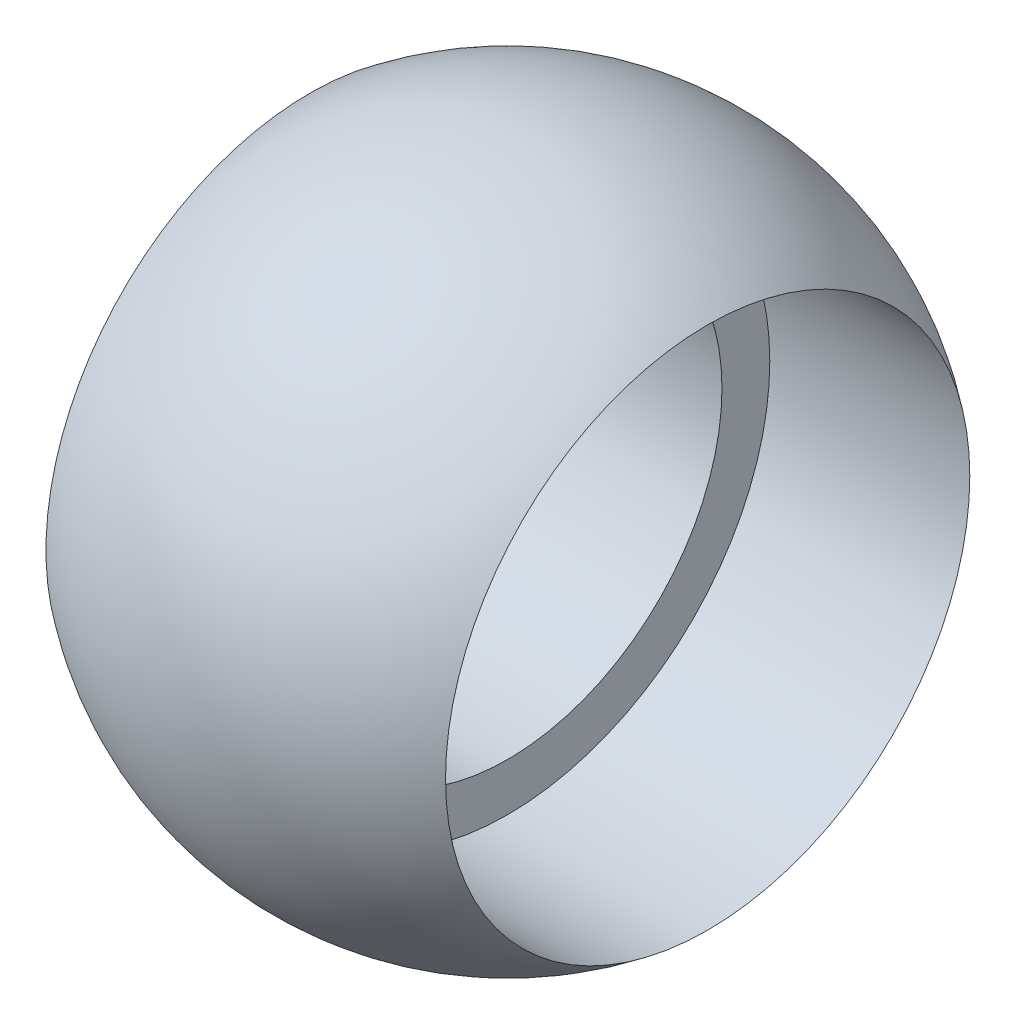
from build123d import *

# Parameters (mm, degrees)
SKETCH2_R          = 13
CUT_EXTRUDE2_DEPTH = 50
CUT_EXTRUDE3_START = -12
SKETCH3_R          = 15.996150205
CUT_EXTRUDE3_DEPTH = 25
SKETCH4_R          = 15.9
CUT_EXTRUDE4_DEPTH = 25


with BuildPart() as part:
    # Sketch1 → Revolve1 (revolve)
    with BuildSketch(Plane(origin=(0, 0, 0), x_dir=(0, 0, -1), z_dir=(1, 0, 0))):
        with BuildLine():
            Line((-20, 0), (20, 0))
            ThreePointArc((20, 0), (0, 20), (-20, 0))
        make_face()
    revolve(axis=Axis((0, 0, 20), (0, 0, -1)))

    # Sketch2 → Cut-Extrude2 (cut, symmetric)
    with BuildSketch(Plane(origin=(0, 0, 0), x_dir=(0, 0, -1), z_dir=(1, 0, 0))):
        with Locations(Location((0, 0, 0), (0, 0, 180))):
            Circle(SKETCH2_R)
    extrude(amount=CUT_EXTRUDE2_DEPTH, both=True, mode=Mode.SUBTRACT)

    # Sketch3 → Cut-Extrude3 (cut)
    with BuildSketch(Plane(origin=(0, 0, 0), x_dir=(0, 0, -1), z_dir=(1, 0, 0)).offset(CUT_EXTRUDE3_START)):
        Circle(SKETCH3_R)
    extrude(amount=-CUT_EXTRUDE3_DEPTH, mode=Mode.SUBTRACT)

    # Sketch4 → Cut-Extrude4 (cut)
    with BuildSketch(Plane(origin=(0, 0, 0), x_dir=(0, 0, -1), z_dir=(1, 0, 0))):
        Circle(SKETCH4_R)
    extrude(amount=CUT_EXTRUDE4_DEPTH, mode=Mode.SUBTRACT)


solid = part.part
